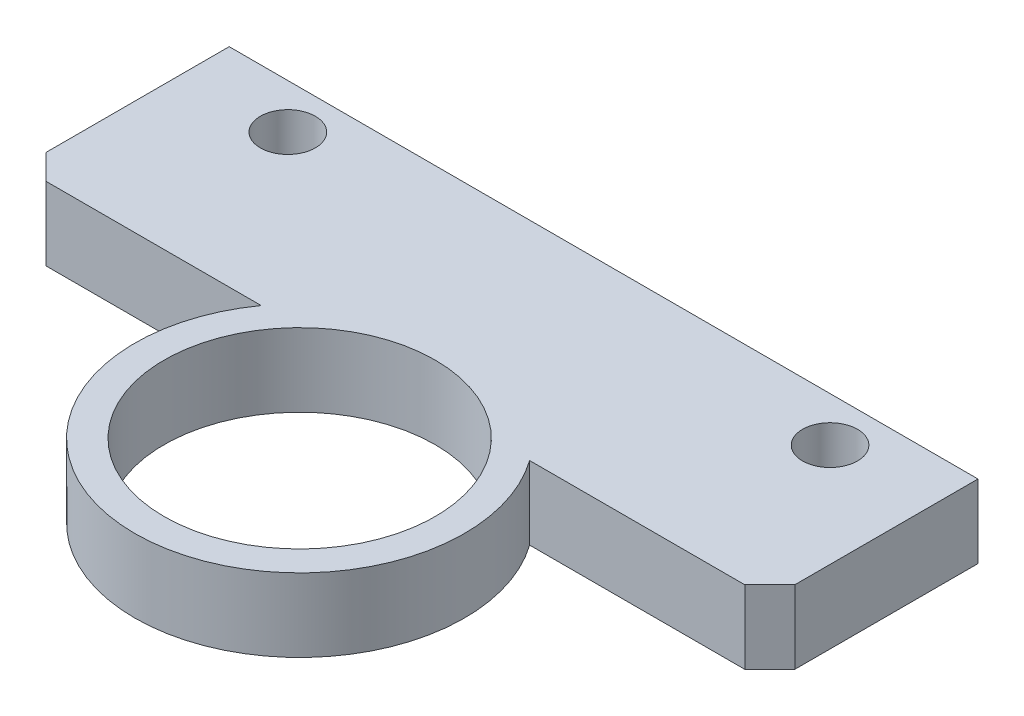
from build123d import *
from build123d.topology import SkipClean

# Parameters (mm, degrees)
SKETCH1_R           = 22.5
SKETCH1_R_2         = 18.5
BOSS_EXTRUDE1_DEPTH = 10
SKETCH2_R           = 3.75
BOSS_EXTRUDE2_DEPTH = 10


with BuildPart() as part:
    # Sketch1 → Boss-Extrude1 (new body)
    with BuildSketch(Plane(origin=(0, 0, 0), x_dir=(1, 0, 0), z_dir=(0, 1, 0))):
        with Locations(Location((0, 0, 0), (0, 0, 270))):
            Circle(SKETCH1_R)
        with Locations(Location((0, 0, 0), (0, 0, 270))):
            Circle(SKETCH1_R_2, mode=Mode.SUBTRACT)
    extrude(amount=BOSS_EXTRUDE1_DEPTH)

    # Sketch2 → Boss-Extrude2 (add)
    with SkipClean():  # the faces are left unmerged after this step: merging them gives an invalid solid
        with BuildSketch(Plane(origin=(0, 0, 0), x_dir=(1, 0, 0), z_dir=(0, 1, 0))):
            with BuildLine():
                Line((18.317381325, 13.066121896), (37, 13.066121896))
                Line((37, 13.066121896), (47.681821621, 13.066121896))
                Line((47.681821621, 13.066121896), (51.096419029, 16.480719304))
                Line((51.096419029, 16.480719304), (51.096419029, 41.480719304))
                Line((51.096419029, 41.480719304), (0, 41.480719304))
                Line((0, 41.480719304), (-51.096419029, 41.480719304))
                Line((-51.096419029, 41.480719304), (-51.096419029, 16.480719304))
                Line((-51.096419029, 16.480719304), (-47.681821621, 13.066121896))
                Line((-47.681821621, 13.066121896), (-37, 13.066121896))
                Line((-37, 13.066121896), (-18.317381325, 13.066121896))
                Line((-18.317381325, 13.066121896), (-13.096811009, 13.066121896))
                ThreePointArc((-13.096811009, 13.066121896), (0, 18.5), (13.096811009, 13.066121896))
                Line((13.096811009, 13.066121896), (18.317381325, 13.066121896))
            make_face()
            with Locations(Location((-37, 35.387659732, 0), (0, 0, 270))):
                Circle(SKETCH2_R, mode=Mode.SUBTRACT)
            with Locations(Location((37, 35.387659732, 0), (0, 0, 270))):
                Circle(SKETCH2_R, mode=Mode.SUBTRACT)
        extrude(amount=BOSS_EXTRUDE2_DEPTH)


solid = part.part
